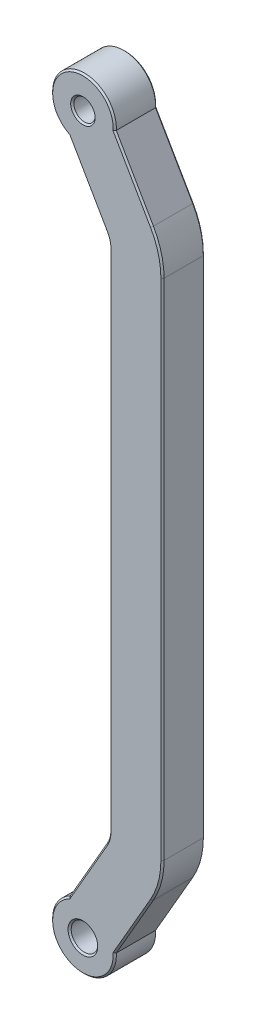
from build123d import *

# Parameters (mm, degrees)
SKETCH_1_R          = 6
EXTRUDE_1_DEPTH     = 8
EXTRUDE_1_2_DEPTH   = 8
EXTRUDE_1_3_DEPTH   = 8
SKETCH_3_R          = 2.5
CUT_EXTRUDE_1_DEPTH = 143.021125189
SKETCH_4_R          = 2
CUT_EXTRUDE_2_DEPTH = 143.021125189
SKETCH_5_R          = 4
CUT_EXTRUDE_3_DEPTH = 4.5
CHAMFER_1_SIZE      = 0.3


with BuildPart() as part:
    # 草图1 → Extrude 1 (new body)
    with BuildSketch(Plane.XY):
        Circle(SKETCH_1_R)
    extrude(amount=EXTRUDE_1_DEPTH)



with BuildPart() as body_2:
    # 草图1 → Extrude 1 2 (new body)
    with BuildSketch(Plane.XY):
        with Locations((0, 135)):
            Circle(SKETCH_1_R)
    extrude(amount=EXTRUDE_1_2_DEPTH)


with BuildPart() as part_1:
    add(part.part)

    add(body_2.part)  # Extrude 1 3 merges body 2
    # 草图2 → Extrude 1 3 (add)
    with BuildSketch(Plane.XY):
        with BuildLine():
            Line((4.330127019, -2.5), (12.990381057, 12.5))
            ThreePointArc((12.990381057, 12.5), (14.488887394, 16.117714323), (15, 20))
            Line((15, 20), (15, 115))
            ThreePointArc((15, 115), (14.488887394, 118.882285677), (12.990381057, 122.5))
            Line((12.990381057, 122.5), (4.330127019, 137.5))
            Line((4.330127019, 137.5), (-4.330127019, 132.5))
            Line((-4.330127019, 132.5), (4.330127019, 117.5))
            ThreePointArc((4.330127019, 117.5), (4.829629131, 116.294095226), (5, 115))
            Line((5, 115), (5, 20))
            ThreePointArc((5, 20), (4.829629131, 18.705904774), (4.330127019, 17.5))
            Line((4.330127019, 17.5), (-4.330127019, 2.5))
            Line((-4.330127019, 2.5), (4.330127019, -2.5))
        make_face()
    extrude(amount=EXTRUDE_1_3_DEPTH)

    # 草图3 → 切除-拉伸1 (cut, through all)
    with BuildSketch(Plane.XY.offset(8)):
        Circle(SKETCH_3_R)
    extrude(amount=-CUT_EXTRUDE_1_DEPTH, mode=Mode.SUBTRACT)

    # 草图4 → 切除-拉伸2 (cut, through all)
    with BuildSketch(Plane(origin=(0, 0, 0), x_dir=(-1, 0, 0), z_dir=(0, 0, -1))):
        with Locations((0, 135)):
            Circle(SKETCH_4_R)
    extrude(amount=-CUT_EXTRUDE_2_DEPTH, mode=Mode.SUBTRACT)

    # 草图5 → 切除-拉伸3 (cut)
    with BuildSketch(Plane(origin=(0, 0, 0), x_dir=(-1, 0, 0), z_dir=(0, 0, -1))):
        with Locations((0, 135)):
            Circle(SKETCH_5_R)
    extrude(amount=-CUT_EXTRUDE_3_DEPTH, mode=Mode.SUBTRACT)

    # 倒角1
    chamfer_1_edges = [part_1.edges().sort_by_distance(p)[0] for p in [
        (0.829156198, 11.436140662, 8),
        (9.489410235, 6.436140662, 0),
        (9.489410235, 128.563859338, 0),
        (0.829156198, 123.563859338, 8),
        (4.829629131, 116.294095226, 8),
        (5, 67.5, 8),
        (4.829629131, 18.705904774, 8),
        (14.488887394, 16.117714323, 0),
        (15, 67.5, 0),
        (14.488887394, 118.882285677, 0),
        (0.829156198, 11.436140662, 0),
        (4.829629131, 18.705904774, 0),
        (5, 67.5, 0),
        (4.829629131, 116.294095226, 0),
        (0.829156198, 123.563859338, 0),
        (9.489410235, 6.436140662, 8),
        (14.488887394, 16.117714323, 8),
        (15, 67.5, 8),
        (14.488887394, 118.882285677, 8),
        (9.489410235, 128.563859338, 8),
        (-3, 140.196152423, 0),
        (-3, 140.196152423, 8),
        (-2.5, 0, 0),
        (-2.5, 0, 8),
        (-3, -5.196152423, 0),
        (2, 135, 8),
        (4, 135, 0),
        (-3, -5.196152423, 8),
    ]]
    chamfer(chamfer_1_edges, length=CHAMFER_1_SIZE)


solid = part_1.part
